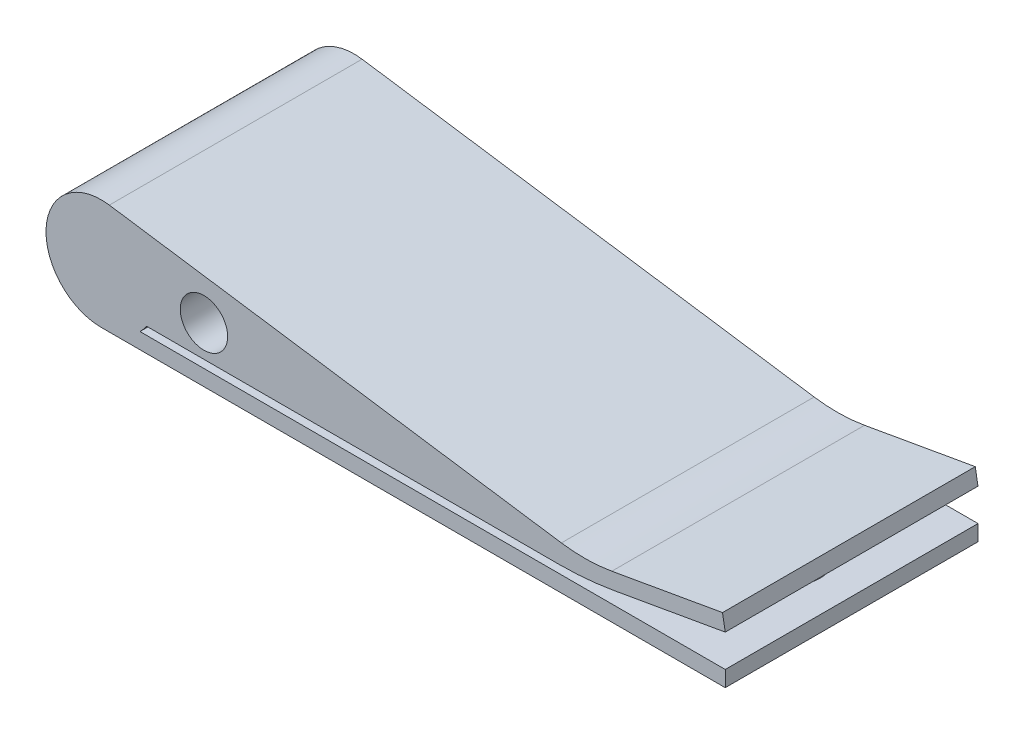
from build123d import *

# Parameters (mm, degrees)
ESTRUSIONE_ESTRUSIONE1_DEPTH = 16
RACCORDO1_R                  = 10
RACCORDO2_R                  = 20
SCHIZZO3_R                   = 1.5
TAGLIO_ESTRUSIONE1_DEPTH     = 16
SCHIZZO4_R                   = 2
TAGLIO_ESTRUSIONE2_DEPTH     = 1


with BuildPart() as part:
    # Schizzo1 → Estrusione-Estrusione1 (new body)
    with BuildSketch(Plane.XY):
        with BuildLine():
            Line((3.5, 0), (43, 0))
            Line((43, 0), (43, 1))
            Line((43, 1), (5.949489743, 1))
            ThreePointArc((5.949489743, 1), (6.17260394, 1.240091112), (6.372281323, 1.5))
            Line((6.372281323, 1.5), (34.226351822, 1.5))
            Line((34.226351822, 1.5), (43, 3.047030893))
            Line((43, 3.047030893), (42.826351822, 4.031838646))
            Line((42.826351822, 4.031838646), (34.226351822, 2.515426612))
            Line((34.226351822, 2.515426612), (4.009636789, 6.962696975))
            ThreePointArc((4.009636789, 6.962696975), (0.009338214, 3.755500085), (3.5, 0))
        make_face()
    extrude(amount=ESTRUSIONE_ESTRUSIONE1_DEPTH)

    # Raccordo1
    raccordo1_edges = [part.edges().sort_by_distance(p)[0] for p in [
        (34.226351822, 2.515426612, 8),
    ]]
    fillet(raccordo1_edges, radius=RACCORDO1_R)

    # Raccordo2
    raccordo2_edges = [part.edges().sort_by_distance(p)[0] for p in [
        (34.226351822, 1.5, 8),
    ]]
    fillet(raccordo2_edges, radius=RACCORDO2_R)

    # Schizzo3 → Taglio-Estrusione1 (cut)
    with BuildSketch(Plane.XY.offset(16)):
        with Locations((10, 3.5)):
            Circle(SCHIZZO3_R)
    extrude(amount=-TAGLIO_ESTRUSIONE1_DEPTH, mode=Mode.SUBTRACT)

    # Schizzo4 → Taglio-Estrusione2 (cut)
    with BuildSketch(Plane.XZ):
        with Locations((39, 8)):
            Circle(SCHIZZO4_R)
        with Locations((16, 8)):
            Circle(SCHIZZO4_R)
    extrude(amount=-TAGLIO_ESTRUSIONE2_DEPTH, mode=Mode.SUBTRACT)


solid = part.part
